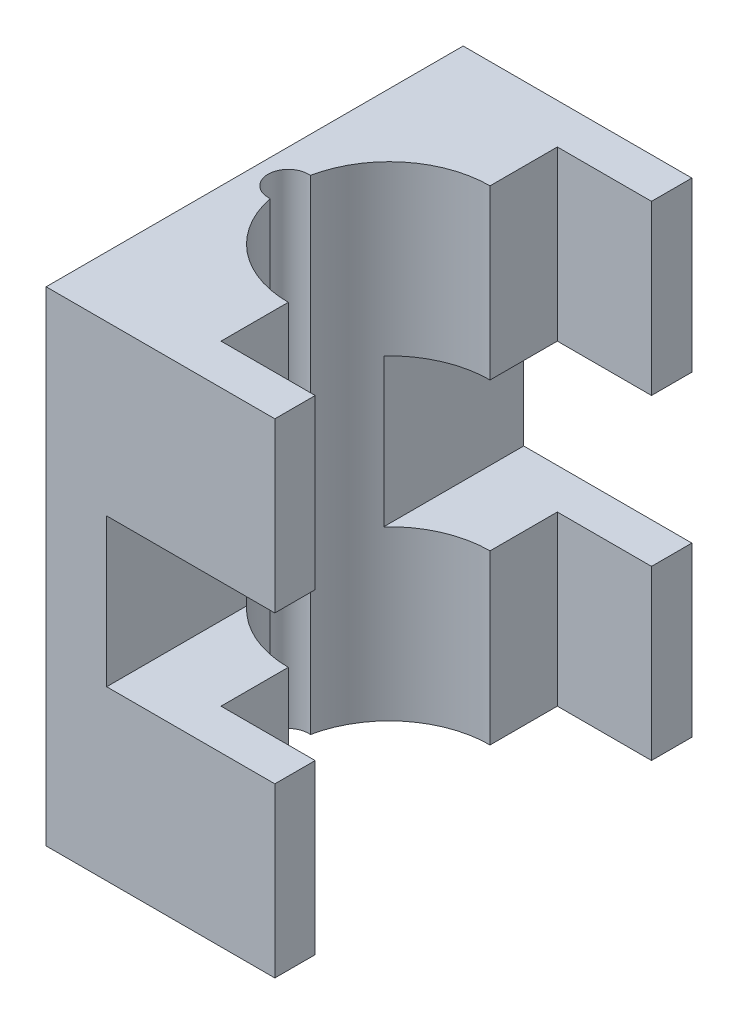
from build123d import *

# Parameters (mm, degrees)
BOSS_EXTRUDE1_DEPTH = 25
BOSS_EXTRUDE2_DEPTH = 22


with BuildPart() as part:
    # Sketch1 → Boss-Extrude1 (new body)
    with BuildSketch(Plane(origin=(0, 0, 0), x_dir=(1, 0, 0), z_dir=(0, 1, 0))):
        with BuildLine():
            Line((0, 25), (14, 25))
            Line((14, 25), (14, 31))
            Line((14, 31), (-20, 31))
            Line((-20, 31), (-20, -31))
            Line((-20, -31), (14, -31))
            Line((14, -31), (14, -25))
            Line((14, -25), (0, -25))
            Line((0, -25), (0, -15))
            ThreePointArc((0, -15), (-9.492775288, -11.614095631), (-14.7, -2.984962311))
            ThreePointArc((-14.7, -2.984962311), (-18, 0), (-14.7, 2.984962311))
            ThreePointArc((-14.7, 2.984962311), (-9.492775288, 11.614095631), (0, 15))
            Line((0, 15), (0, 25))
        make_face()
    boss_extrude1 = extrude(amount=BOSS_EXTRUDE1_DEPTH)

    # Sketch2 → Boss-Extrude2 (add)
    with BuildSketch(Plane(origin=(0, 25, 0), x_dir=(1, 0, 0), z_dir=(0, 1, 0))):
        with BuildLine():
            Line((-20, 31), (-20, -31))
            Line((-20, -31), (-11, -31))
            Line((-11, -31), (-11, -10.198039027))
            ThreePointArc((-11, -10.198039027), (-13.346520855, -6.846194642), (-14.7, -2.984962311))
            ThreePointArc((-14.7, -2.984962311), (-18, 0), (-14.7, 2.984962311))
            ThreePointArc((-14.7, 2.984962311), (-13.346520855, 6.846194642), (-11, 10.198039027))
            Line((-11, 10.198039027), (-11, 31))
            Line((-11, 31), (-20, 31))
        make_face()
    extrude(amount=BOSS_EXTRUDE2_DEPTH)

    # Mirror1: Boss-Extrude1 across plane
    add(boss_extrude1.mirror(Plane.ZX.offset(36)))


solid = part.part
